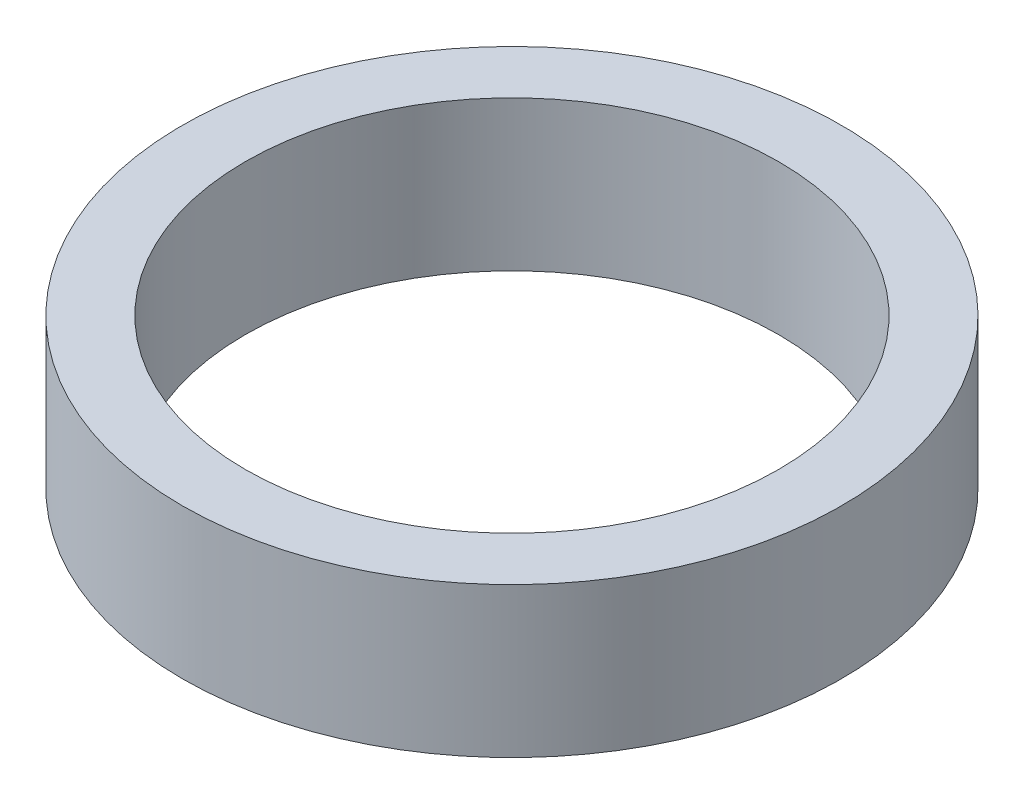
from build123d import *

# Parameters (mm, degrees)
SKETCH1_R           = 11
SKETCH1_R_2         = 8.9
BOSS_EXTRUDE1_DEPTH = 5


with BuildPart() as part:
    # Sketch1 → Boss-Extrude1 (new body)
    with BuildSketch(Plane(origin=(0, 0, 0), x_dir=(1, 0, 0), z_dir=(0, 1, 0))):
        with Locations(Location((0, 0, 0), (0, 0, 270))):
            Circle(SKETCH1_R)
        with Locations(Location((0, 0, 0), (0, 0, 270))):
            Circle(SKETCH1_R_2, mode=Mode.SUBTRACT)
    extrude(amount=BOSS_EXTRUDE1_DEPTH)


solid = part.part
